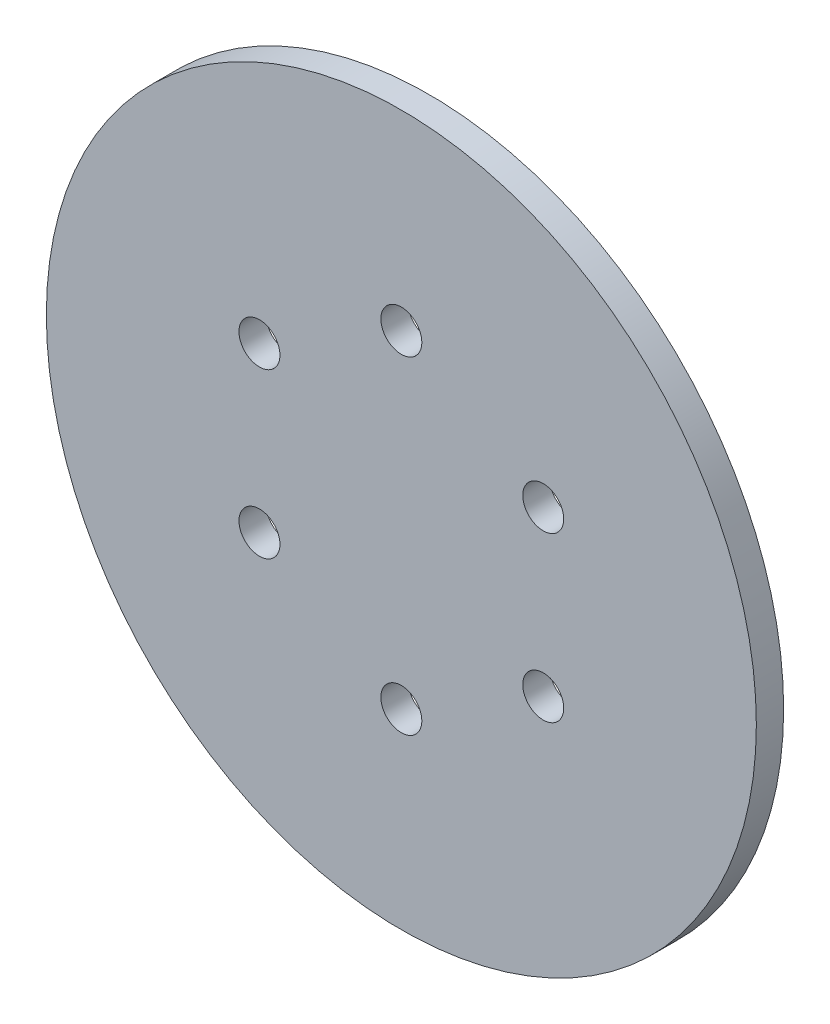
from build123d import *

# Parameters (mm, degrees)
SKETCH1_R           = 41.275
SKETCH1_R_2         = 2.38125
BOSS_EXTRUDE1_DEPTH = 3.175


with BuildPart() as part:
    # Sketch1 → Boss-Extrude1 (new body)
    with BuildSketch(Plane.XY):
        Circle(SKETCH1_R)
        with Locations((0, 19.05)):
            Circle(SKETCH1_R_2, mode=Mode.SUBTRACT)
        with Locations((16.497783942, 9.525)):
            Circle(SKETCH1_R_2, mode=Mode.SUBTRACT)
        with Locations((16.497783942, -9.525)):
            Circle(SKETCH1_R_2, mode=Mode.SUBTRACT)
        with Locations((0, -19.05)):
            Circle(SKETCH1_R_2, mode=Mode.SUBTRACT)
        with Locations((-16.497783942, -9.525)):
            Circle(SKETCH1_R_2, mode=Mode.SUBTRACT)
        with Locations((-16.497783942, 9.525)):
            Circle(SKETCH1_R_2, mode=Mode.SUBTRACT)
    extrude(amount=BOSS_EXTRUDE1_DEPTH)


solid = part.part
